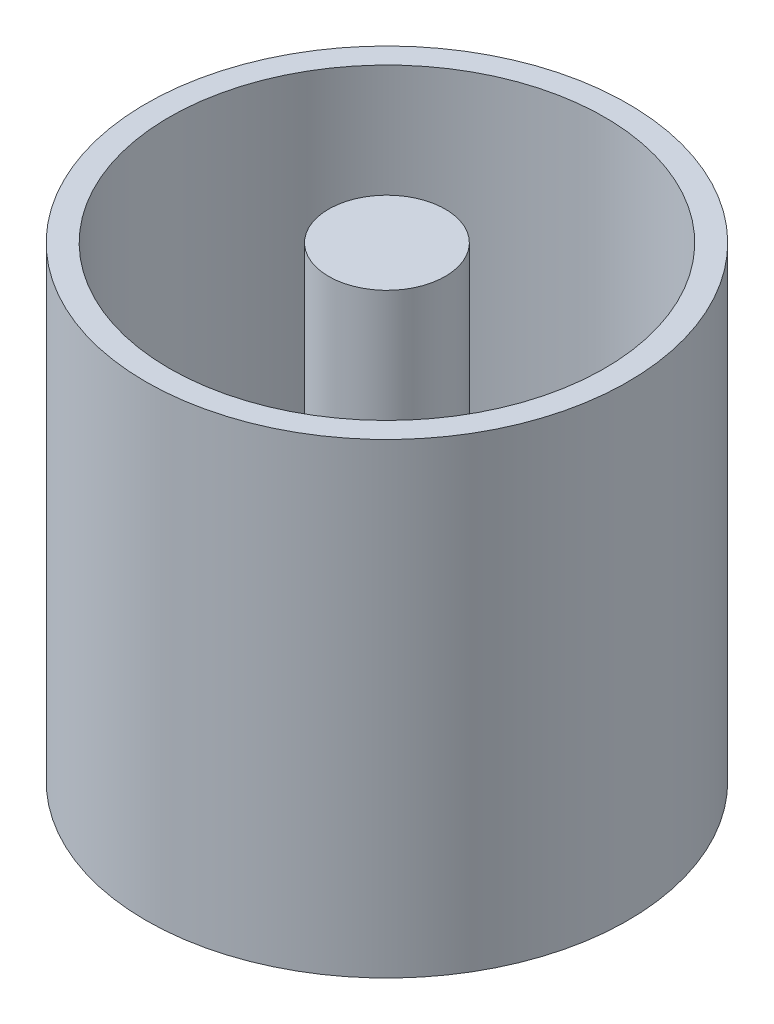
from build123d import *

# Parameters (mm, degrees)
SKETCH1_R           = 15.5
BOSS_EXTRUDE1_DEPTH = 30
SKETCH2_R           = 14
CUT_EXTRUDE1_DEPTH  = 27
SKETCH3_R           = 1
CUT_EXTRUDE2_DEPTH  = 10
SKETCH4_R           = 3.75
BOSS_EXTRUDE2_DEPTH = 27


with BuildPart() as part:
    # Sketch1 → Boss-Extrude1 (new body)
    with BuildSketch(Plane(origin=(0, 0, 0), x_dir=(1, 0, 0), z_dir=(0, 1, 0))):
        with Locations(Location((0, 0, 0), (0, 0, 270))):
            Circle(SKETCH1_R)
    extrude(amount=BOSS_EXTRUDE1_DEPTH)

    # Sketch2 → Cut-Extrude1 (cut)
    with BuildSketch(Plane(origin=(0, 30, 0), x_dir=(1, 0, 0), z_dir=(0, 1, 0))):
        with Locations(Location((0, 0, 0), (0, 0, 270))):
            Circle(SKETCH2_R)
    extrude(amount=-CUT_EXTRUDE1_DEPTH, mode=Mode.SUBTRACT)

    # Sketch3 → Cut-Extrude2 (cut)
    with BuildSketch(Plane.XZ):
        with Locations(Location((-9, 0, 0), (0, 0, 270))):
            Circle(SKETCH3_R)
        with Locations(Location((-12.5, 0, 0), (0, 0, 270))):
            Circle(SKETCH3_R)
    extrude(amount=-CUT_EXTRUDE2_DEPTH, mode=Mode.SUBTRACT)

    # Sketch4 → Boss-Extrude2 (add)
    with BuildSketch(Plane(origin=(0, 3, 0), x_dir=(1, 0, 0), z_dir=(0, 1, 0))):
        with Locations(Location((0, 0, 0), (0, 0, 270))):
            Circle(SKETCH4_R)
    extrude(amount=BOSS_EXTRUDE2_DEPTH)


solid = part.part
